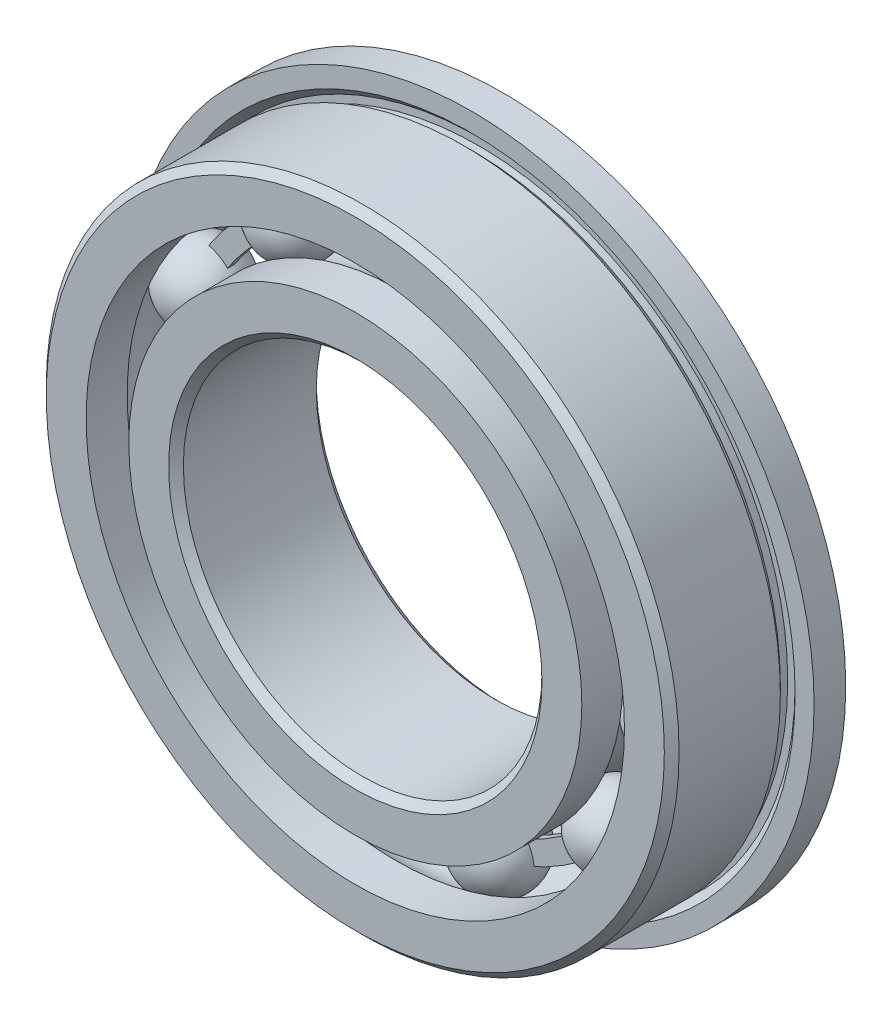
from build123d import *

# Parameters (mm, degrees)
SKETCH6_W         = 0.336996336
SKETCH6_H         = 1.01098901
CIRPATTERN1_COUNT = 11


with BuildPart() as part:
    # Sketch1 → Revolve1 (revolve)
    with BuildSketch(Plane(origin=(0, 0, 0), x_dir=(0, 0, -1), z_dir=(1, 0, 0))):
        with BuildLine():
            Line((-3.15, 15), (-3.5, 14.65))
            Line((-3.5, 14.65), (-3.5, 12.760989011))
            Line((-3.5, 12.760989011), (-1.555555556, 12.760989011))
            ThreePointArc((-1.555555556, 12.760989011), (0, 13.605222862), (1.555555556, 12.760989011))
            Line((1.555555556, 12.760989011), (3.5, 12.760989011))
            Line((3.5, 12.760989011), (3.5, 14.65))
            Line((3.5, 14.65), (3.5, 16.25))
            Line((3.5, 16.25), (2, 16.25))
            Line((2, 16.25), (2, 15.35))
            Line((2, 15.35), (2.35, 15))
            Line((2.35, 15), (2.35, 14.65))
            Line((2.35, 14.65), (2, 14.65))
            Line((2, 14.65), (1.65, 15))
            Line((1.65, 15), (-3.15, 15))
        make_face()
    revolve(axis=Axis((0, 0, 3.5), (0, 0, -1)))


with BuildPart() as body_2:
    # Sketch3 → Revolve3 (revolve)
    with BuildSketch(Plane(origin=(0, 0, 0), x_dir=(0, 0, -1), z_dir=(1, 0, 0))):
        with BuildLine():
            Line((-3.5, 10.739010989), (-1.555555556, 10.739010989))
            ThreePointArc((-1.555555556, 10.739010989), (0, 9.894777138), (1.555555556, 10.739010989))
            Line((1.555555556, 10.739010989), (3.5, 10.739010989))
            Line((3.5, 10.739010989), (3.5, 8.85))
            Line((3.5, 8.85), (3.15, 8.5))
            Line((3.15, 8.5), (-3.15, 8.5))
            Line((-3.15, 8.5), (-3.5, 8.85))
            Line((-3.5, 8.85), (-3.5, 10.739010989))
        make_face()
    revolve(axis=Axis((0, 0, 3.5), (0, 0, -1)))


with BuildPart() as body_3:
    # Sketch6 → Revolve6 (revolve)
    with BuildSketch(Plane(origin=(0, 0, 0), x_dir=(0, 0, -1), z_dir=(1, 0, 0))):
        with Locations((0, 11.75)):
            Rectangle(SKETCH6_W, SKETCH6_H)
    revolve(axis=Axis((0, 0, 3.5), (0, 0, -1)))


with BuildPart() as body_4:
    # Sketch4 → Revolve4 (revolve)
    with BuildSketch(Plane(origin=(0, 0, 0), x_dir=(0, 0, -1), z_dir=(1, 0, 0))):
        with BuildLine():
            Line((-1.855222862, 11.75), (1.855222862, 11.75))
            ThreePointArc((1.855222862, 11.75), (0, 13.605222862), (-1.855222862, 11.75))
        make_face()
    revolve(axis=Axis((0, 11.75, 1.855222862), (0, 0, -1)))


with BuildPart() as cirpattern1_1:
    # CirPattern1: pattern copy
    add(body_4.part.rotate(Axis((0, 0, -3.5), (0, 0, 1)), 1 * 360 / CIRPATTERN1_COUNT))


with BuildPart() as cirpattern1_2:
    # CirPattern1: pattern copy
    add(body_4.part.rotate(Axis((0, 0, -3.5), (0, 0, 1)), 2 * 360 / CIRPATTERN1_COUNT))


with BuildPart() as cirpattern1_3:
    # CirPattern1: pattern copy
    add(body_4.part.rotate(Axis((0, 0, -3.5), (0, 0, 1)), 3 * 360 / CIRPATTERN1_COUNT))


with BuildPart() as cirpattern1_4:
    # CirPattern1: pattern copy
    add(body_4.part.rotate(Axis((0, 0, -3.5), (0, 0, 1)), 4 * 360 / CIRPATTERN1_COUNT))


with BuildPart() as cirpattern1_5:
    # CirPattern1: pattern copy
    add(body_4.part.rotate(Axis((0, 0, -3.5), (0, 0, 1)), 5 * 360 / CIRPATTERN1_COUNT))


with BuildPart() as cirpattern1_6:
    # CirPattern1: pattern copy
    add(body_4.part.rotate(Axis((0, 0, -3.5), (0, 0, 1)), 6 * 360 / CIRPATTERN1_COUNT))


with BuildPart() as cirpattern1_7:
    # CirPattern1: pattern copy
    add(body_4.part.rotate(Axis((0, 0, -3.5), (0, 0, 1)), 7 * 360 / CIRPATTERN1_COUNT))


with BuildPart() as cirpattern1_8:
    # CirPattern1: pattern copy
    add(body_4.part.rotate(Axis((0, 0, -3.5), (0, 0, 1)), 8 * 360 / CIRPATTERN1_COUNT))


with BuildPart() as cirpattern1_9:
    # CirPattern1: pattern copy
    add(body_4.part.rotate(Axis((0, 0, -3.5), (0, 0, 1)), 9 * 360 / CIRPATTERN1_COUNT))


with BuildPart() as cirpattern1_10:
    # CirPattern1: pattern copy
    add(body_4.part.rotate(Axis((0, 0, -3.5), (0, 0, 1)), 10 * 360 / CIRPATTERN1_COUNT))


solid = Compound([part.part, body_2.part, body_3.part, body_4.part, cirpattern1_1.part, cirpattern1_2.part, cirpattern1_3.part, cirpattern1_4.part, cirpattern1_5.part, cirpattern1_6.part, cirpattern1_7.part, cirpattern1_8.part, cirpattern1_9.part, cirpattern1_10.part])
